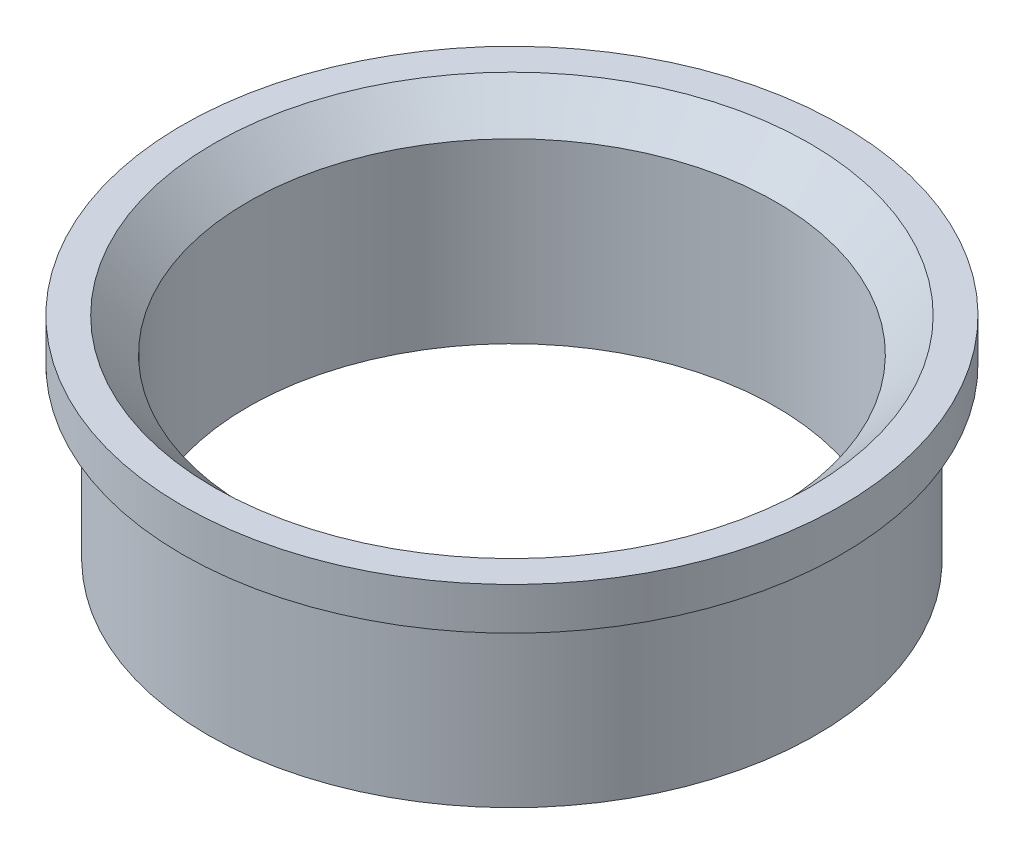
from build123d import *


with BuildPart() as part:
    # Sketch1 → Revolve1 (revolve)
    with BuildSketch(Plane.XY, mode=Mode.PRIVATE) as revolve1_sk:
        Polygon((62.5, 0), (62.5, 42), (70.5, 50), (78, 50), (78, 40), (72, 40), (72, 0), align=None)
    revolve(revolve1_sk.sketch.rotate(Axis((0, 43.175456222, 0), (0, -1, 0)), 90), axis=Axis((0, 43.175456222, 0), (0, -1, 0)))


solid = part.part
